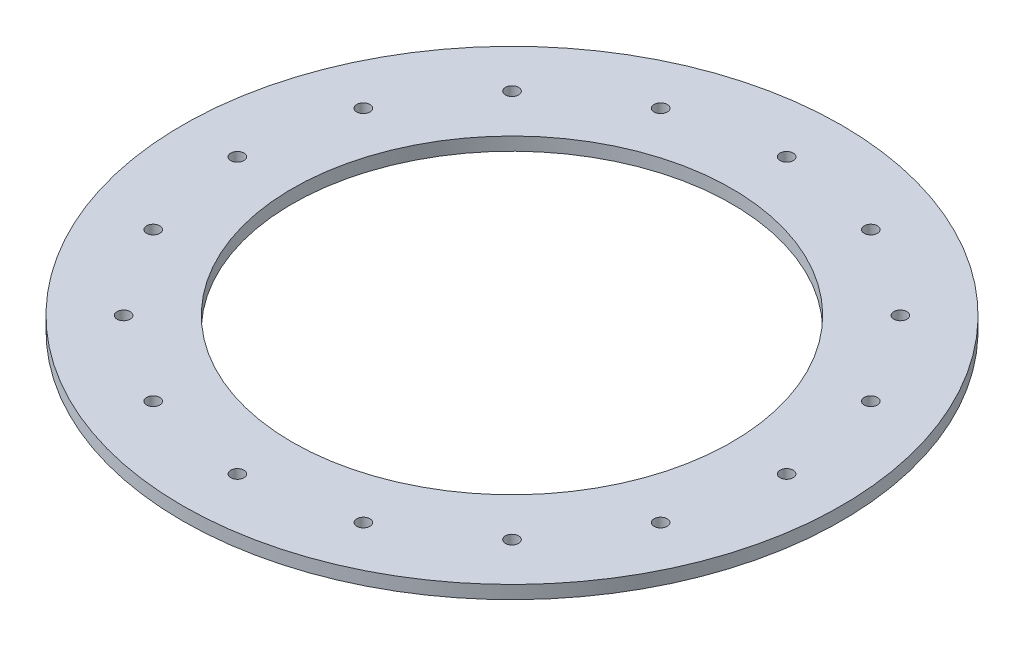
from build123d import *

# Parameters (mm, degrees)
SKETCH2_R           = 37.5
SKETCH2_R_2         = 25
SKETCH2_R_3         = 0.75
BOSS_EXTRUDE2_DEPTH = 1.5


with BuildPart() as part:
    # Sketch2 → Boss-Extrude2 (new body)
    with BuildSketch(Plane(origin=(0, 0, 0), x_dir=(1, 0, 0), z_dir=(0, 1, 0))):
        with Locations(Location((0, 0, 0), (0, 0, 270))):
            Circle(SKETCH2_R)
        with Locations(Location((0, 0, 0), (0, 0, 270))):
            Circle(SKETCH2_R_2, mode=Mode.SUBTRACT)
        with Locations(Location((0, 31.25, 0), (0, 0, 270))):
            Circle(SKETCH2_R_3, mode=Mode.SUBTRACT)
        with Locations(Location((11.958857261, 28.871235391, 0), (0, 0, 270))):
            Circle(SKETCH2_R_3, mode=Mode.SUBTRACT)
        with Locations(Location((22.097086912, 22.097086912, 0), (0, 0, 270))):
            Circle(SKETCH2_R_3, mode=Mode.SUBTRACT)
        with Locations(Location((28.871235391, 11.958857261, 0), (0, 0, 270))):
            Circle(SKETCH2_R_3, mode=Mode.SUBTRACT)
        with Locations(Location((31.25, 0, 0), (0, 0, 270))):
            Circle(SKETCH2_R_3, mode=Mode.SUBTRACT)
        with Locations(Location((28.871235391, -11.958857261, 0), (0, 0, 270))):
            Circle(SKETCH2_R_3, mode=Mode.SUBTRACT)
        with Locations(Location((22.097086912, -22.097086912, 0), (0, 0, 270))):
            Circle(SKETCH2_R_3, mode=Mode.SUBTRACT)
        with Locations(Location((11.958857261, -28.871235391, 0), (0, 0, 270))):
            Circle(SKETCH2_R_3, mode=Mode.SUBTRACT)
        with Locations(Location((0, -31.25, 0), (0, 0, 270))):
            Circle(SKETCH2_R_3, mode=Mode.SUBTRACT)
        with Locations(Location((-11.958857261, -28.871235391, 0), (0, 0, 270))):
            Circle(SKETCH2_R_3, mode=Mode.SUBTRACT)
        with Locations(Location((-22.097086912, -22.097086912, 0), (0, 0, 270))):
            Circle(SKETCH2_R_3, mode=Mode.SUBTRACT)
        with Locations(Location((-28.871235391, -11.958857261, 0), (0, 0, 270))):
            Circle(SKETCH2_R_3, mode=Mode.SUBTRACT)
        with Locations(Location((-31.25, 0, 0), (0, 0, 270))):
            Circle(SKETCH2_R_3, mode=Mode.SUBTRACT)
        with Locations(Location((-28.871235391, 11.958857261, 0), (0, 0, 270))):
            Circle(SKETCH2_R_3, mode=Mode.SUBTRACT)
        with Locations(Location((-22.097086912, 22.097086912, 0), (0, 0, 270))):
            Circle(SKETCH2_R_3, mode=Mode.SUBTRACT)
        with Locations(Location((-11.958857261, 28.871235391, 0), (0, 0, 270))):
            Circle(SKETCH2_R_3, mode=Mode.SUBTRACT)
    extrude(amount=BOSS_EXTRUDE2_DEPTH)


solid = part.part
